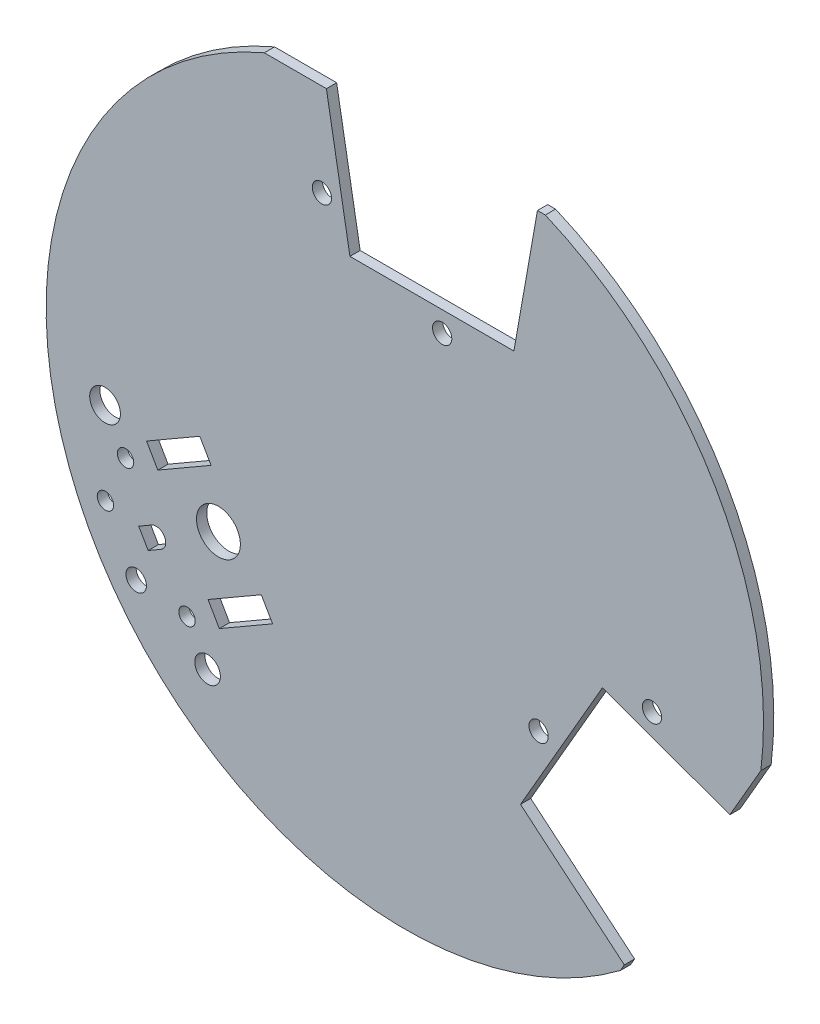
from build123d import *

# Parameters (mm, degrees)
ESQUISSE1_R             = 175
BOSS_EXTRU_1_DEPTH      = 5
ESQUISSE2_R             = 4.7
ENL_V_MAT_EXTRU_1_DEPTH = 5
LEDS_BOUT_TIRETTE_R     = 10.7
LEDS_BOUT_TIRETTE_R_2   = 6.25
LEDS_BOUT_TIRETTE_R_3   = 4
LEDS_BOUT_TIRETTE_R_4   = 5
LEDS_BOUT_TIRETTE_R_5   = 7.5
ENL_V_MAT_EXTRU_2_DEPTH = 10


with BuildPart() as part:
    # Esquisse1 → Boss.-Extru.1 (new body)
    with BuildSketch(Plane.XY):
        Circle(ESQUISSE1_R)
    extrude(amount=BOSS_EXTRU_1_DEPTH)

    # Esquisse2 → Enlèv. mat.-Extru.1 (cut)
    with BuildSketch(Plane(origin=(0, 0, 0), x_dir=(-1, 0, 0), z_dir=(0, 0, -1))):
        with Locations((-18.220426897, 85.887612711)):
            Circle(ESQUISSE2_R)
        with Locations((40.460378836, 115.887612711)):
            Circle(ESQUISSE2_R)
        with Locations((-65.270641029, -58.723158916)):
            Circle(ESQUISSE2_R)
        with Locations((-120.59180601, -22.904090436)):
            Circle(ESQUISSE2_R)
        Polygon((26.7795731, 95.88761271), (38.263317053, 161.015161015), (68.550112498, 161.015161015), (68.550112498, 190.246123658), (-94.990966298, 190.246123658), (-94.990966298, 161.015161015), (-64.704170853, 161.015161015), (-53.2204269, 95.88761271), align=None)
        Polygon((-96.430895065, -24.752015748), (-158.57487836, -47.370575906), (-173.718276082, -21.141441652), (-199.033032308, -35.756922974), (-117.262492911, -177.387651773), (-91.947736684, -162.772170451), (-107.091134406, -136.543036197), (-56.430895065, -94.034048051), align=None)
    extrude(amount=-ENL_V_MAT_EXTRU_1_DEPTH, mode=Mode.SUBTRACT)

    # Leds, bout., tirette → Enlèv. mat.-Extru.2 (cut)
    with BuildSketch(Plane.XY.offset(5)):
        with Locations((-90.932667397, -52.5)):
            Circle(LEDS_BOUT_TIRETTE_R)
        with Locations((-96.24355653, -113.301270189)):
            Circle(LEDS_BOUT_TIRETTE_R_2)
        with Locations((-136.24355653, -44.019237886)):
            Circle(LEDS_BOUT_TIRETTE_R_3)
        with Locations((-106.24355653, -95.980762114)):
            Circle(LEDS_BOUT_TIRETTE_R_3)
        with Locations((-146.064064606, -67.009618943)):
            Circle(LEDS_BOUT_TIRETTE_R_3)
        with Locations((-131.064064606, -92.990381057)):
            Circle(LEDS_BOUT_TIRETTE_R_4)
        with Locations((-146.24355653, -26.698729811)):
            Circle(LEDS_BOUT_TIRETTE_R_5)
        with BuildLine():
            Line((-118.94355653, -73.983716857), (-125.222240707, -77.608716857))
            Line((-125.222240707, -77.608716857), (-129.822240707, -69.641283143))
            Line((-129.822240707, -69.641283143), (-123.54355653, -66.016283143))
            ThreePointArc((-123.54355653, -66.016283143), (-117.259839672, -67.7), (-118.94355653, -73.983716857))
        make_face()
        Polygon((-126.003175473, -31.756098166), (-100.02241336, -16.756098166), (-94.52241336, -26.282377607), (-120.503175473, -41.282377607), align=None)
        Polygon((-96.003175473, -83.717622393), (-70.02241336, -68.717622393), (-64.52241336, -78.243901834), (-90.503175473, -93.243901834), align=None)
    extrude(amount=-ENL_V_MAT_EXTRU_2_DEPTH, mode=Mode.SUBTRACT)


solid = part.part
